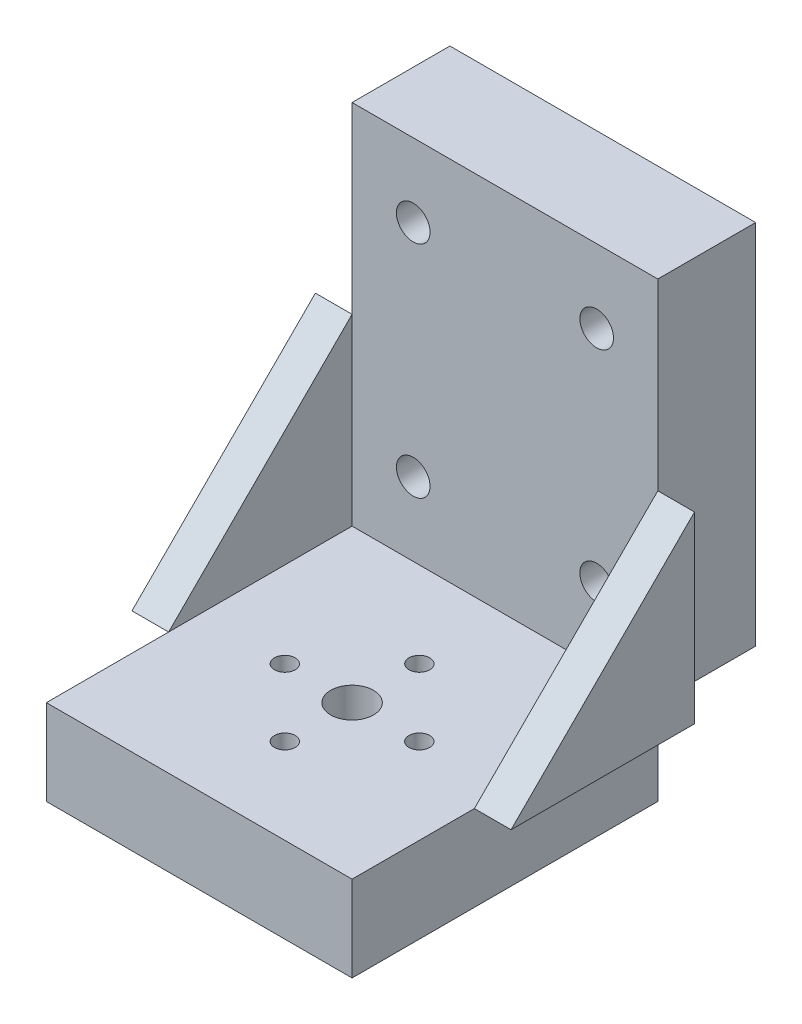
from build123d import *

# Parameters (mm, degrees)
SKETCH1_W         = 50
SKETCH1_H         = 50
SKETCH1_R         = 3.5
MOTOR_BASE_DEPTH  = 14
SKETCH2_W         = 16
SKETCH2_H         = 60
WALL_MOUNT_DEPTH  = 50
SKETCH6_R         = 1.7
MOTOR_HOLES_DEPTH = 77.850504227
SKETCH8_R         = 2.75
WALL_HOLES_DEPTH  = 93.741576437
GUSSET1_DEPTH     = 6


with BuildPart() as part:
    # Sketch1 → Motor Base (new body)
    with BuildSketch(Plane(origin=(0, 0, 0), x_dir=(1, 0, 0), z_dir=(0, 1, 0))):
        Rectangle(SKETCH1_W, SKETCH1_H)
        with Locations(Location((0, 0, 0), (0, 0, 270))):
            Circle(SKETCH1_R, mode=Mode.SUBTRACT)
    extrude(amount=MOTOR_BASE_DEPTH)

    # Sketch6 → Motor Holes (cut, through all)
    with BuildSketch(Plane(origin=(0, 14, 0), x_dir=(1, 0, 0), z_dir=(0, 1, 0))):
        with Locations(Location((0, 11, 0), (0, 0, 270))):
            Circle(SKETCH6_R)
        with Locations(Location((11, 0, 0), (0, 0, 270))):
            Circle(SKETCH6_R)
        with Locations(Location((0, -11, 0), (0, 0, 270))):
            Circle(SKETCH6_R)
        with Locations(Location((-11, 0, 0), (0, 0, 270))):
            Circle(SKETCH6_R)
    extrude(amount=-MOTOR_HOLES_DEPTH, mode=Mode.SUBTRACT)


with BuildPart() as body_2:
    # Sketch2 → Wall Mount (new, through all)
    with BuildSketch(Plane(origin=(25, 0, 0), x_dir=(0, 0, -1), z_dir=(1, 0, 0))):
        with Locations((33, 44)):
            Rectangle(SKETCH2_W, SKETCH2_H)
    extrude(amount=-WALL_MOUNT_DEPTH)

    # Sketch8 → Wall Holes (cut, through all)
    with BuildSketch(Plane.XY.offset(-25)):
        with Locations((-15, 62)):
            Circle(SKETCH8_R)
        with Locations((15, 62)):
            Circle(SKETCH8_R)
        with Locations((15, 26)):
            Circle(SKETCH8_R)
        with Locations((-15, 26)):
            Circle(SKETCH8_R)
    extrude(amount=-WALL_HOLES_DEPTH, mode=Mode.SUBTRACT)


with BuildPart() as body_3:
    # Sketch10 → gusset1 (new body)
    with BuildSketch(Plane.ZY.offset(25)):
        Polygon((-25, 14), (5, 14), (-25, 44), align=None)
    extrude(amount=GUSSET1_DEPTH)


with BuildPart() as body_4:
    # Mirror2: mirrored copy
    add(body_3.part.mirror(Plane(origin=(0, 0, 0), x_dir=(0, 0, 1), z_dir=(1, 0, 0))))


solid = Compound([part.part, body_2.part, body_3.part, body_4.part])
